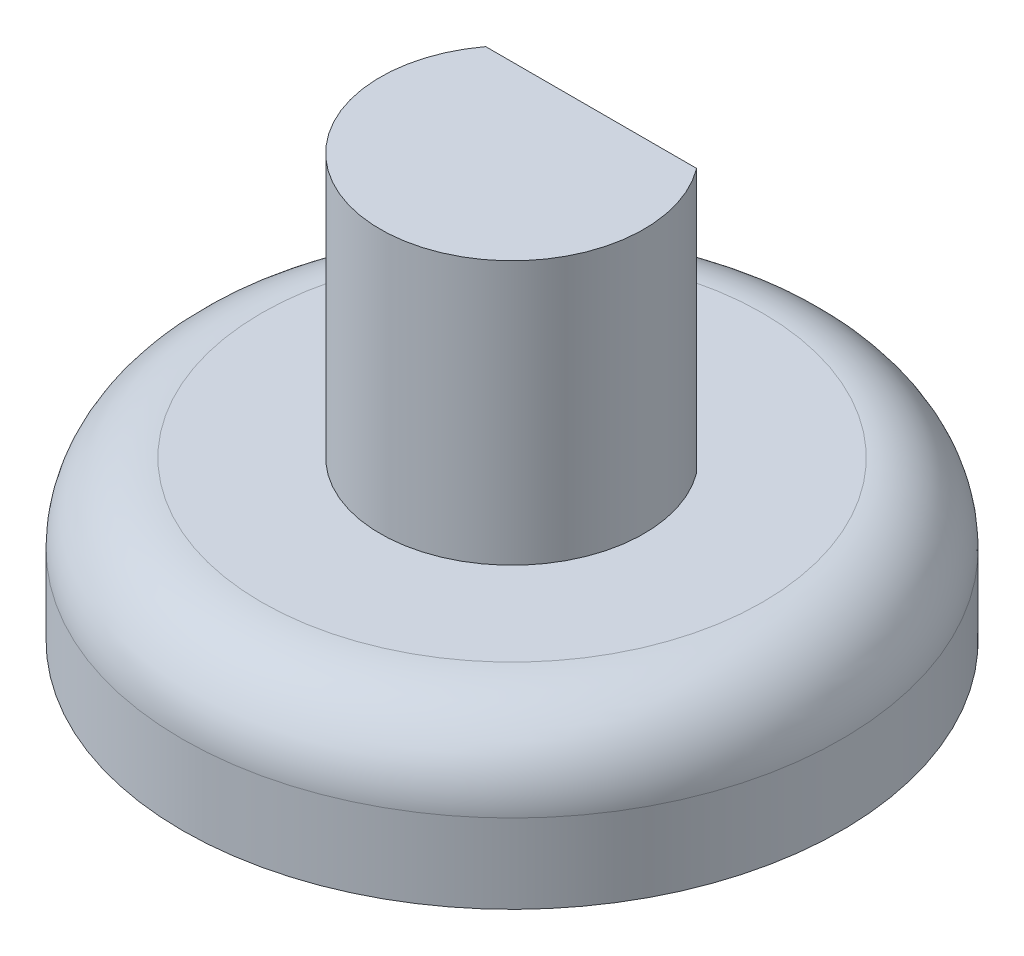
from build123d import *

# Parameters (mm, degrees)
SKETCH1_R           = 6.25
BOSS_EXTRUDE1_DEPTH = 3
BOSS_EXTRUDE2_DEPTH = 5
FILLET1_R           = 1.5


with BuildPart() as part:
    # Sketch1 → Boss-Extrude1 (new body)
    with BuildSketch(Plane(origin=(0, 0, 0), x_dir=(1, 0, 0), z_dir=(0, 1, 0))):
        with Locations(Location((0, 0, 0), (0, 0, 270))):
            Circle(SKETCH1_R)
    extrude(amount=BOSS_EXTRUDE1_DEPTH)

    # Sketch2 → Boss-Extrude2 (add)
    with BuildSketch(Plane(origin=(0, 3, 0), x_dir=(1, 0, 0), z_dir=(0, 1, 0))):
        with BuildLine():
            Line((-2, 1.5), (2, 1.5))
            ThreePointArc((2, 1.5), (0, -2.5), (-2, 1.5))
        make_face()
    extrude(amount=BOSS_EXTRUDE2_DEPTH)

    # Fillet1
    fillet1_edges = [part.edges().sort_by_distance(p)[0] for p in [
        (0, 3, -6.25),
    ]]
    fillet(fillet1_edges, radius=FILLET1_R)


solid = part.part
